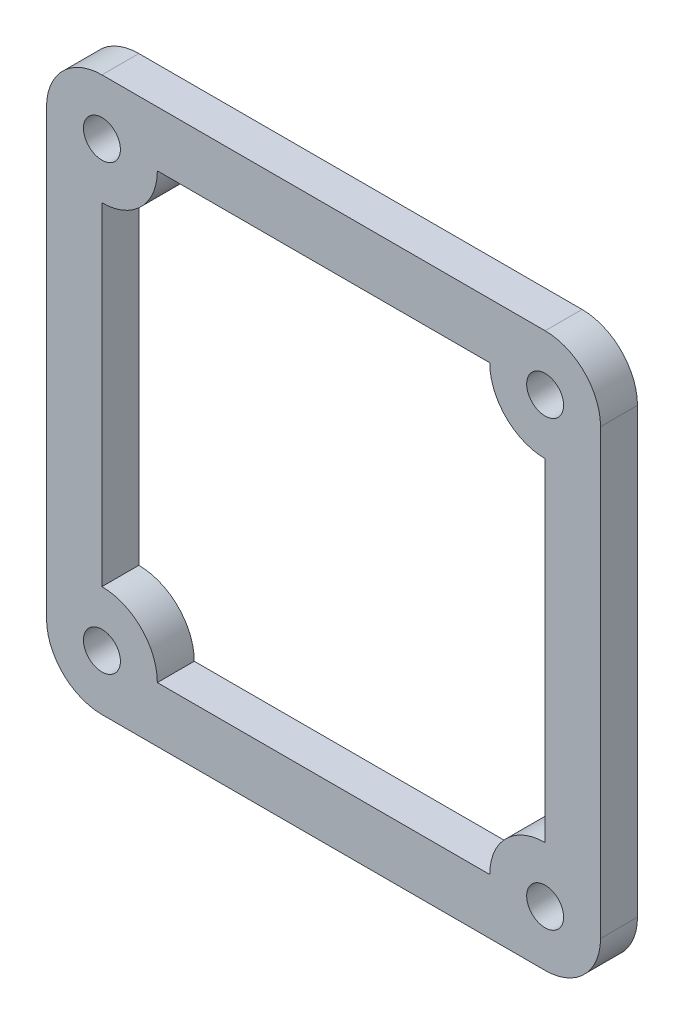
from build123d import *

# Parameters (mm, degrees)
MODEL_R                 = 1.5
SALIENTE_EXTRUIR1_DEPTH = 3


with BuildPart() as part:
    # Model → Saliente-Extruir1 (new body)
    with BuildSketch(Plane.XY):
        with BuildLine():
            Line((-105.943383637, 101.056539338), (-105.943383637, 65.056539338))
            ThreePointArc((-105.943383637, 65.056539338), (-104.625364152, 61.874558823), (-101.443383637, 60.556539338))
            Line((-101.443383637, 60.556539338), (-65.443383637, 60.556539338))
            ThreePointArc((-65.443383637, 60.556539338), (-62.261403122, 61.874558823), (-60.943383637, 65.056539338))
            Line((-60.943383637, 65.056539338), (-60.943383637, 101.056539338))
            ThreePointArc((-60.943383637, 101.056539338), (-62.261403122, 104.238519853), (-65.443383637, 105.556539338))
            Line((-65.443383637, 105.556539338), (-101.443383637, 105.556539338))
            ThreePointArc((-101.443383637, 105.556539338), (-104.625364152, 104.238519853), (-105.943383637, 101.056539338))
        make_face()
        with Locations((-101.443383637, 101.056539338)):
            Circle(MODEL_R, mode=Mode.SUBTRACT)
        with Locations((-65.443383637, 101.056539338)):
            Circle(MODEL_R, mode=Mode.SUBTRACT)
        with Locations((-101.443383637, 65.056539338)):
            Circle(MODEL_R, mode=Mode.SUBTRACT)
        with Locations((-65.443383637, 65.056539338)):
            Circle(MODEL_R, mode=Mode.SUBTRACT)
        with BuildLine():
            Line((-101.443383637, 96.556539338), (-101.443383637, 69.556539338))
            ThreePointArc((-101.443383637, 69.556539338), (-98.261403122, 68.238519853), (-96.943383637, 65.056539338))
            Line((-96.943383637, 65.056539338), (-69.943383637, 65.056539338))
            ThreePointArc((-69.943383637, 65.056539338), (-68.625364152, 68.238519853), (-65.443383637, 69.556539338))
            Line((-65.443383637, 69.556539338), (-65.443383637, 96.556539338))
            ThreePointArc((-65.443383637, 96.556539338), (-68.625364152, 97.874558823), (-69.943383637, 101.056539338))
            Line((-69.943383637, 101.056539338), (-96.943383637, 101.056539338))
            ThreePointArc((-96.943383637, 101.056539338), (-98.261403122, 97.874558823), (-101.443383637, 96.556539338))
        make_face(mode=Mode.SUBTRACT)
    extrude(amount=SALIENTE_EXTRUIR1_DEPTH)


solid = part.part
